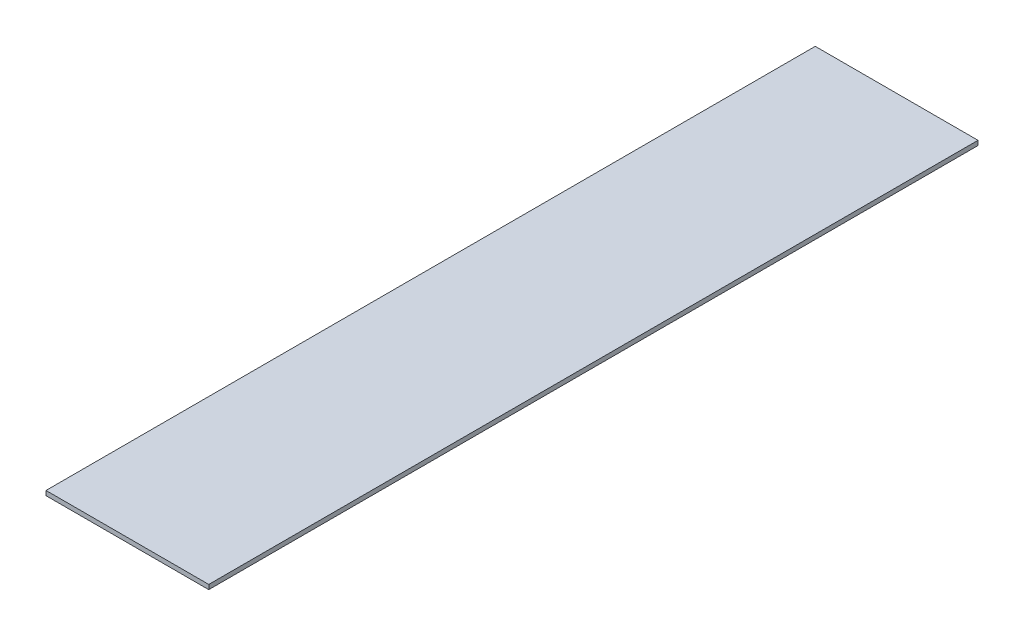
from build123d import *

# Parameters (mm, degrees)
SKETCH1_W           = 44.75
SKETCH1_H           = 1.25
BOSS_EXTRUDE1_DEPTH = 211.5


with BuildPart() as part:
    # Sketch1 → Boss-Extrude1 (new body)
    with BuildSketch(Plane.XY):
        Rectangle(SKETCH1_W, SKETCH1_H)
    extrude(amount=BOSS_EXTRUDE1_DEPTH)


solid = part.part
